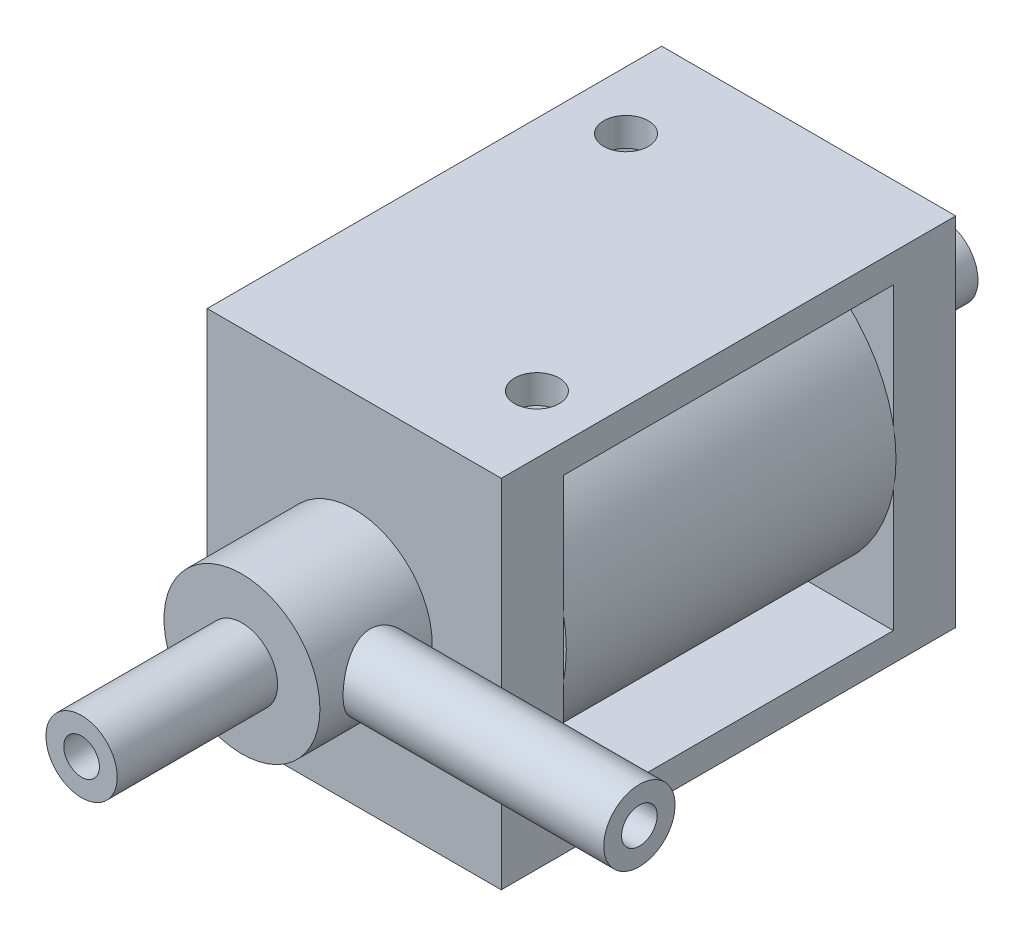
from build123d import *

# Parameters (mm, degrees)
FRAME_EXTRUDE_DEPTH                     = 8.25
FRAME_EXTRUDE_DEPTH_BACK                = 8.25
FRAME_SKETCH_W                          = 25.5
FRAME_SKETCH_H                          = 20
FRAME_SKETCH_W_2                        = 18.5
FRAME_SKETCH_H_2                        = 16.8
ELECTROMAGNET_EXTRUDE_REACH             = 20.183
ELECTROMAGNET_SKETCH_R                  = 8.4
ELECTROMAGNET_EXTRUDE_DIRECTION_2_REACH = 20.183
PORT_3_SKETCH_R                         = 2
PORT_3_SKETCH_R_2                       = 1
PORT_3_EXTRUDE_DEPTH                    = 7.5
PORT_3_SKETCH_3_R                       = 1
CENTER_HOLE_CUT_DEPTH                   = 29.649781849
BASE_OF_PORTS_1_2_SKETCH_R              = 4.375
BASE_OF_PORT_1_2_PORTS_DEPTH            = 6.3
PORT_2_SKETCH_R                         = 2
PORT_2_SKETCH_R_2                       = 1
PORT_2_EXTRUDE_DEPTH                    = 9
PORTS_1_SKETCH_R                        = 2
PORTS_1_SKETCH_R_2                      = 1
PORTS_1_EXTRUDE_DEPTH                   = 19
MOUNTING_HOLES_PROFILE_SKETCH_W         = 1.25
MOUNTING_HOLES_PROFILE_SKETCH_H         = 3.250185188
MOUNTING_HOLES_AT_2_COUNT               = 2
MOUNTING_HOLES_AT_2_PITCH               = 18.027756377


with BuildPart() as part:
    # Frame Sketch → Frame Extrude (new, two sides: drawn at the far end of the back side and taken through both)
    with BuildSketch(Plane(origin=(0, 0, 0), x_dir=(0, 0, -1), z_dir=(1, 0, 0)).offset(-FRAME_EXTRUDE_DEPTH_BACK)):
        Rectangle(FRAME_SKETCH_W, FRAME_SKETCH_H)
        Rectangle(FRAME_SKETCH_W_2, FRAME_SKETCH_H_2, mode=Mode.SUBTRACT)
    extrude(amount=FRAME_EXTRUDE_DEPTH + FRAME_EXTRUDE_DEPTH_BACK)


with BuildPart() as body_2:

    # Electromagnet Extrude: up to this face of the body (flat: up to its plane)
    electromagnet_extrude_end = Plane(part.part.faces().sort_by_distance((0, 0, 9.25))[0])
    # Electromagnet Sketch → Electromagnet Extrude (new, up to the picked face)
    with BuildSketch(Plane.XY, mode=Mode.PRIVATE) as electromagnet_extrude_sk1:
        with Locations(Location((0, 0, 0), (0, 0, 90))):
            Circle(ELECTROMAGNET_SKETCH_R)
    electromagnet_extrude_tool1 = split(extrude(electromagnet_extrude_sk1.sketch, amount=ELECTROMAGNET_EXTRUDE_REACH, mode=Mode.PRIVATE), bisect_by=electromagnet_extrude_end, keep=Keep.BOTH, mode=Mode.PRIVATE)
    add(electromagnet_extrude_tool1.solids().sort_by(Axis((0, 0, 0), (0, 0, 1)))[0])


    # Electromagnet Extrude direction 2: up to this face of the body (flat: up to its plane)
    electromagnet_extrude_direction_2_end = Plane(part.part.faces().sort_by_distance((0, 0, -9.25))[0])
    # Electromagnet Sketch → Electromagnet Extrude direction 2 (add, up to the picked face)
    with BuildSketch(Plane.XY, mode=Mode.PRIVATE) as electromagnet_extrude_direction_2_sk1:
        with Locations(Location((0, 0, 0), (0, 0, 90))):
            Circle(ELECTROMAGNET_SKETCH_R)
    electromagnet_extrude_direction_2_tool1 = split(extrude(electromagnet_extrude_direction_2_sk1.sketch, amount=-ELECTROMAGNET_EXTRUDE_DIRECTION_2_REACH, mode=Mode.PRIVATE), bisect_by=electromagnet_extrude_direction_2_end, keep=Keep.BOTH, mode=Mode.PRIVATE)
    add(electromagnet_extrude_direction_2_tool1.solids().sort_by(Axis((0, 0, 0), (0, 0, -1)))[0])


with BuildPart() as part_1:
    add(part.part)

    # Port 3 Sketch → Port 3 Extrude (add)
    with BuildSketch(Plane.XY.offset(-12.75)):
        Circle(PORT_3_SKETCH_R)
        Circle(PORT_3_SKETCH_R_2, mode=Mode.SUBTRACT)
    extrude(amount=-PORT_3_EXTRUDE_DEPTH)


with BuildPart() as center_hole_cut_tool:
    # Port 3 Sketch<3> → Center Hole Cut (new, through all)
    with BuildSketch(Plane.XY.offset(-12.75)):
        with Locations(Location((0, 0, 0), (0, 0, 90))):
            Circle(PORT_3_SKETCH_3_R)
    extrude(amount=CENTER_HOLE_CUT_DEPTH)


with BuildPart() as part_2:
    add(part_1.part)

    # Center Hole Cut: cut by center_hole_cut_tool
    add(center_hole_cut_tool.part, mode=Mode.SUBTRACT)

    # Mounting Holes Profile Sketch → Mounting Holes (revolve, cut)
    with BuildSketch(Plane(origin=(5, 10, 7.5), x_dir=(0, 0, 1), z_dir=(1, 0, 0))):
        with Locations((0.625, 1.625092594)):
            Rectangle(MOUNTING_HOLES_PROFILE_SKETCH_W, MOUNTING_HOLES_PROFILE_SKETCH_H)
    mounting_holes = revolve(axis=Axis((5, 16.35, 7.5), (0, -1, 0)), mode=Mode.SUBTRACT)

    # Mounting Holes at 2: Mounting Holes ×2
    with Locations(*[Vector(-0.5547001962252294, 0, -0.8320502943378435) * (i * MOUNTING_HOLES_AT_2_PITCH) for i in range(1, MOUNTING_HOLES_AT_2_COUNT)]):
        add(mounting_holes, mode=Mode.SUBTRACT)


with BuildPart() as body_2_1:
    add(body_2.part)

    # Center Hole Cut: cut by center_hole_cut_tool
    add(center_hole_cut_tool.part, mode=Mode.SUBTRACT)


with BuildPart() as body_3:
    # Base of Ports 1&2 Sketch → Base of Port 1&2 Ports (new body)
    with BuildSketch(Plane.XY.offset(12.75)):
        Circle(BASE_OF_PORTS_1_2_SKETCH_R)
    extrude(amount=BASE_OF_PORT_1_2_PORTS_DEPTH)

    # Port 2 Sketch → Port 2 Extrude (add)
    with BuildSketch(Plane.XY.offset(19.05)):
        Circle(PORT_2_SKETCH_R)
        Circle(PORT_2_SKETCH_R_2, mode=Mode.SUBTRACT)
    extrude(amount=PORT_2_EXTRUDE_DEPTH)

    # Ports 1 Sketch → Ports 1 Extrude (add)
    with BuildSketch(Plane(origin=(0, 2.609545443, 0), x_dir=(0, 0, -1), z_dir=(-1, 0, 0))):
        with Locations(Location((-15.75, 2.609545443, 0), (0, 0, 180))):
            Circle(PORTS_1_SKETCH_R)
        with Locations(Location((-15.75, 2.609545443, 0), (0, 0, 180))):
            Circle(PORTS_1_SKETCH_R_2, mode=Mode.SUBTRACT)
    extrude(amount=-PORTS_1_EXTRUDE_DEPTH)


solid = Compound([part_2.part, body_2_1.part, body_3.part])
